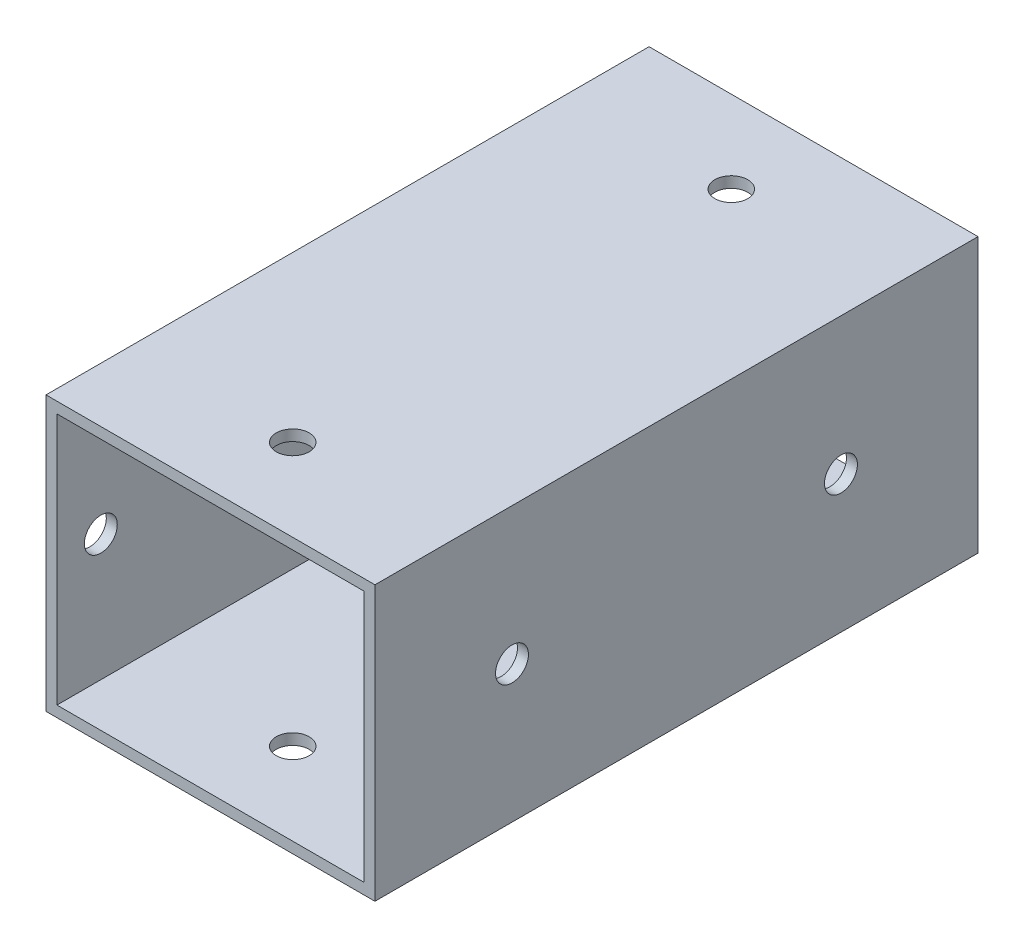
from build123d import *

# Parameters (mm, degrees)
SKETCH_1_W          = 30
SKETCH_1_H          = 25
SKETCH_1_W_2        = 28
SKETCH_1_H_2        = 23
EXTRUDE_1_DEPTH     = 27.5
SKETCH_2_R          = 1.5
CUT_EXTRUDE_1_DEPTH = 70
SKETCH_3_R          = 1.5
CUT_EXTRUDE_2_DEPTH = 20
SKETCH_4_R          = 1.5
CUT_EXTRUDE_3_DEPTH = 20


with BuildPart() as part:
    # 草图1 → 凸台-拉伸1 (new, symmetric)
    with BuildSketch(Plane.XY):
        Rectangle(SKETCH_1_W, SKETCH_1_H)
        Rectangle(SKETCH_1_W_2, SKETCH_1_H_2, mode=Mode.SUBTRACT)
    extrude(amount=EXTRUDE_1_DEPTH, both=True)

    # 草图2 → 切除-拉伸1 (cut)
    with BuildSketch(Plane(origin=(0, 12.5, 0), x_dir=(1, 0, 0), z_dir=(0, 1, 0))):
        with Locations(Location((0, 20, 0), (0, 0, 270))):
            Circle(SKETCH_2_R)
        with Locations(Location((0, -20, 0), (0, 0, 270))):
            Circle(SKETCH_2_R)
    extrude(amount=-CUT_EXTRUDE_1_DEPTH, mode=Mode.SUBTRACT)

    # 草图3 → 切除-拉伸2 (cut)
    with BuildSketch(Plane(origin=(-14, 0, 0), x_dir=(0, 0, -1), z_dir=(1, 0, 0))):
        Circle(SKETCH_3_R)
        with Locations((-23.5, 0)):
            Circle(SKETCH_3_R)
        with Locations((23.5, 0)):
            Circle(SKETCH_3_R)
    extrude(amount=-CUT_EXTRUDE_2_DEPTH, mode=Mode.SUBTRACT)

    # 草图4 → 切除-拉伸3 (cut)
    with BuildSketch(Plane(origin=(15, 0, 0), x_dir=(0, 0, -1), z_dir=(1, 0, 0))):
        with Locations((15, 0)):
            Circle(SKETCH_4_R)
        with Locations((-15, 0)):
            Circle(SKETCH_4_R)
    extrude(amount=-CUT_EXTRUDE_3_DEPTH, mode=Mode.SUBTRACT)


solid = part.part
